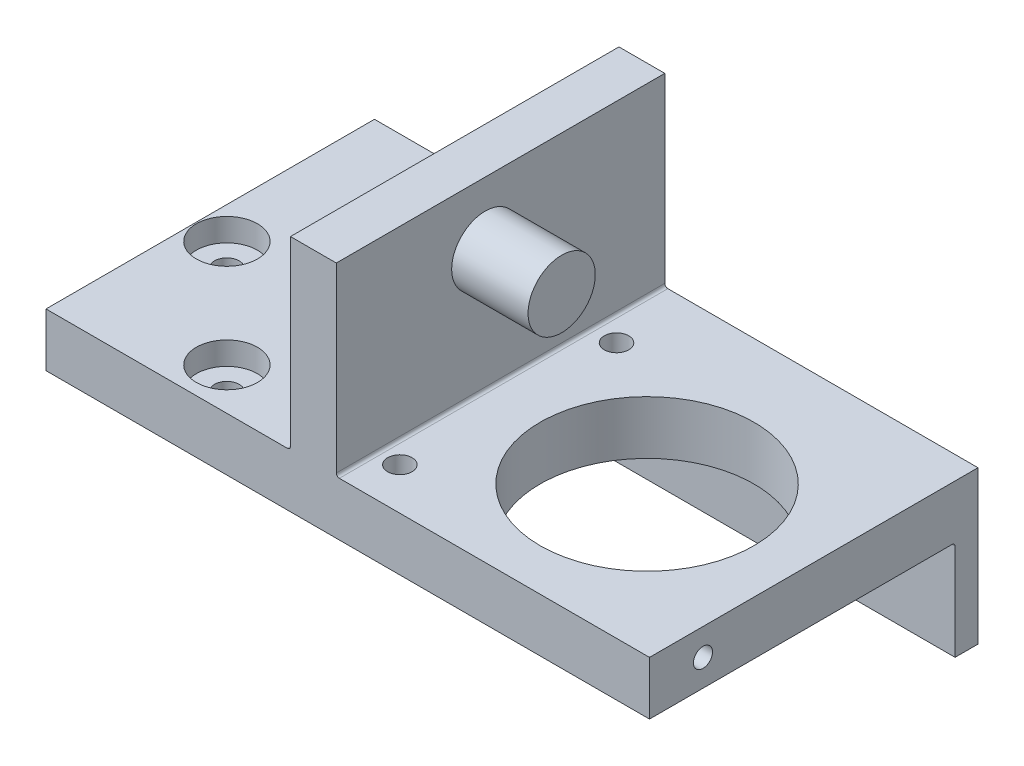
from build123d import *

# Parameters (mm, degrees)
SKETCH_1_W               = 39.5
SKETCH_1_H               = 3.5
EXTRUDE_1_DEPTH          = 19.5
CUT_EXTRUDE_1_REACH      = 44.062
SKETCH_3_R               = 7
EXTRUDE_START            = -3.5
SKETCH_4_W               = 39.5
SKETCH_4_H               = 2
EXTRUDE_2_DEPTH          = 10
CUT_EXTRUDE_2_REACH      = 45.092
SKETCH_5_R               = 0.8
HOLE_WIZARD_M1_6_1_D     = 1.25
HOLE_WIZARD_M1_6_1_DEPTH = 4.15
HOLE_WIZARD_M1_6_1_TIP   = 0.375537887
HOLE_WIZARD_M1_6_2_D     = 1.25
HOLE_WIZARD_M1_6_2_DEPTH = 4.15
HOLE_WIZARD_M1_6_2_TIP   = 0.375537887
SKETCH_10_W              = 21.5
SKETCH_10_H              = 12.103276992
EXTRUDE_3_DEPTH          = 3
SKETCH_11_R              = 2.2
EXTRUDE_4_DEPTH          = 5
SKETCH_12_W              = 39.5
SKETCH_12_H              = 0.5
CUT_EXTRUDE_3_DEPTH      = 6.5
FILLET_1_R               = 0.2
FILLET_2_R               = 0.2
SKETCH_13_R              = 2
CUT_EXTRUDE_4_DEPTH      = 1.5


with BuildPart() as part:
    # 草图1 → 凸台-拉伸1 (new body)
    with BuildSketch(Plane.XY):
        with Locations((-17.354026846, 0.57630481)):
            Rectangle(SKETCH_1_W, SKETCH_1_H)
    extrude(amount=EXTRUDE_1_DEPTH)

    # 草图3 → 切除-拉伸1 (cut, up to next)
    with BuildSketch(Plane(origin=(0, 2.32630481, 0), x_dir=(1, 0, 0), z_dir=(0, 1, 0)), mode=Mode.PRIVATE) as cut_extrude_1_sk1:
        with Locations(Location((-7.514026846, -9.75, 0), (0, 0, 270))):
            Circle(SKETCH_3_R)
    cut_extrude_1_tool1 = extrude(cut_extrude_1_sk1.sketch, amount=-CUT_EXTRUDE_1_REACH, mode=Mode.PRIVATE) & part.part
    add(cut_extrude_1_tool1.solids().sort_by_distance((-7.514027, 2.326305, 9.75))[0], mode=Mode.SUBTRACT)

    # 草图4 → 凸台-拉伸2 (add)
    with BuildSketch(Plane.XZ.offset(1.17369519).offset(EXTRUDE_START)):
        with Locations((-17.354026846, -1)):
            Rectangle(SKETCH_4_W, SKETCH_4_H)
    extrude(amount=EXTRUDE_2_DEPTH)

    # 草图5 → 切除-拉伸2 (cut, up to next)
    with BuildSketch(Plane(origin=(0, 2.32630481, 0), x_dir=(1, 0, 0), z_dir=(0, 1, 0)), mode=Mode.PRIVATE) as cut_extrude_2_sk1:
        with Locations(Location((-35.014026846, -9.75, 0), (0, 0, 270))):
            Circle(SKETCH_5_R)
    cut_extrude_2_tool1 = extrude(cut_extrude_2_sk1.sketch, amount=-CUT_EXTRUDE_2_REACH, mode=Mode.PRIVATE) & part.part
    # 草图5 → 切除-拉伸2 (cut, up to next)
    with BuildSketch(Plane(origin=(0, 2.32630481, 0), x_dir=(1, 0, 0), z_dir=(0, 1, 0)), mode=Mode.PRIVATE) as cut_extrude_2_sk2:
        with Locations(Location((-28.014026846, -2.75, 0), (0, 0, 270))):
            Circle(SKETCH_5_R)
    cut_extrude_2_tool2 = extrude(cut_extrude_2_sk2.sketch, amount=-CUT_EXTRUDE_2_REACH, mode=Mode.PRIVATE) & part.part
    # 草图5 → 切除-拉伸2 (cut, up to next)
    with BuildSketch(Plane(origin=(0, 2.32630481, 0), x_dir=(1, 0, 0), z_dir=(0, 1, 0)), mode=Mode.PRIVATE) as cut_extrude_2_sk3:
        with Locations(Location((-28.014026846, -16.75, 0), (0, 0, 270))):
            Circle(SKETCH_5_R)
    cut_extrude_2_tool3 = extrude(cut_extrude_2_sk3.sketch, amount=-CUT_EXTRUDE_2_REACH, mode=Mode.PRIVATE) & part.part
    # 草图5 → 切除-拉伸2 (cut, up to next)
    with BuildSketch(Plane(origin=(0, 2.32630481, 0), x_dir=(1, 0, 0), z_dir=(0, 1, 0)), mode=Mode.PRIVATE) as cut_extrude_2_sk4:
        with Locations(Location((-16.514026846, -2.75, 0), (0, 0, 270))):
            Circle(SKETCH_5_R)
    cut_extrude_2_tool4 = extrude(cut_extrude_2_sk4.sketch, amount=-CUT_EXTRUDE_2_REACH, mode=Mode.PRIVATE) & part.part
    # 草图5 → 切除-拉伸2 (cut, up to next)
    with BuildSketch(Plane(origin=(0, 2.32630481, 0), x_dir=(1, 0, 0), z_dir=(0, 1, 0)), mode=Mode.PRIVATE) as cut_extrude_2_sk5:
        with Locations(Location((-16.694026846, -16.75, 0), (0, 0, 270))):
            Circle(SKETCH_5_R)
    cut_extrude_2_tool5 = extrude(cut_extrude_2_sk5.sketch, amount=-CUT_EXTRUDE_2_REACH, mode=Mode.PRIVATE) & part.part
    add(cut_extrude_2_tool1.solids().sort_by_distance((-35.014027, 2.326305, 9.75))[0], mode=Mode.SUBTRACT)
    add(cut_extrude_2_tool2.solids().sort_by_distance((-28.014027, 2.326305, 2.75))[0], mode=Mode.SUBTRACT)
    add(cut_extrude_2_tool3.solids().sort_by_distance((-28.014027, 2.326305, 16.75))[0], mode=Mode.SUBTRACT)
    add(cut_extrude_2_tool4.solids().sort_by_distance((-16.514027, 2.326305, 2.75))[0], mode=Mode.SUBTRACT)
    add(cut_extrude_2_tool5.solids().sort_by_distance((-16.694027, 2.326305, 16.75))[0], mode=Mode.SUBTRACT)

    # M1.6 螺纹孔1
    with Locations(Plane.ZY.offset(37.104026846)):
        with Locations((16, 0.57630481)):
            Hole(HOLE_WIZARD_M1_6_1_D / 2, depth=HOLE_WIZARD_M1_6_1_DEPTH)
            with Locations((0, 0, -(HOLE_WIZARD_M1_6_1_DEPTH + HOLE_WIZARD_M1_6_1_TIP / 2))):  # 118° drill point
                Cone(0, HOLE_WIZARD_M1_6_1_D / 2, HOLE_WIZARD_M1_6_1_TIP, mode=Mode.SUBTRACT)

    # M1.6 螺纹孔2
    with Locations(Plane(origin=(2.395973154, 0, 0), x_dir=(0, 0, -1), z_dir=(1, 0, 0))):
        with Locations((-16, 0.57630481)):
            Hole(HOLE_WIZARD_M1_6_2_D / 2, depth=HOLE_WIZARD_M1_6_2_DEPTH)
            with Locations((0, 0, -(HOLE_WIZARD_M1_6_2_DEPTH + HOLE_WIZARD_M1_6_2_TIP / 2))):  # 118° drill point
                Cone(0, HOLE_WIZARD_M1_6_2_D / 2, HOLE_WIZARD_M1_6_2_TIP, mode=Mode.SUBTRACT)

    # 草图10 → 凸台-拉伸3 (add)
    with BuildSketch(Plane.ZY.offset(18.104026846)):
        with Locations((8.75, 8.377943306)):
            Rectangle(SKETCH_10_W, SKETCH_10_H)
    extrude(amount=EXTRUDE_3_DEPTH)

    # 草图11 → 凸台-拉伸4 (add)
    with BuildSketch(Plane.ZY.offset(18.104026846)):
        with Locations((9.75, 10.299581802)):
            Circle(SKETCH_11_R)
    extrude(amount=-EXTRUDE_4_DEPTH)

    # 草图12 → 切除-拉伸3 (cut)
    with BuildSketch(Plane.XZ.offset(7.67369519)):
        with Locations((-17.354026846, -0.25)):
            Rectangle(SKETCH_12_W, SKETCH_12_H)
    extrude(amount=-CUT_EXTRUDE_3_DEPTH, mode=Mode.SUBTRACT)

    # 圆角1
    fillet_1_edges = [part.edges().sort_by_distance(p)[0] for p in [
        (-17.354026846, -1.17369519, -0.5),
    ]]
    fillet(fillet_1_edges, radius=FILLET_1_R)

    # 圆角2
    fillet_2_edges = [part.edges().sort_by_distance(p)[0] for p in [
        (-18.104026846, 2.32630481, 8.75),
        (-21.104026846, 2.32630481, 8.75),
    ]]
    fillet(fillet_2_edges, radius=FILLET_2_R)

    # 草图13 → 切除-拉伸4 (cut)
    with BuildSketch(Plane(origin=(0, 2.32630481, 0), x_dir=(1, 0, 0), z_dir=(0, 1, 0))):
        with Locations(Location((-28.014026846, -2.75, 0), (0, 0, 270))):
            Circle(SKETCH_13_R)
        with Locations(Location((-28.014026846, -16.75, 0), (0, 0, 270))):
            Circle(SKETCH_13_R)
        with Locations(Location((-35.014026846, -9.75, 0), (0, 0, 270))):
            Circle(SKETCH_13_R)
    extrude(amount=-CUT_EXTRUDE_4_DEPTH, mode=Mode.SUBTRACT)


solid = part.part
